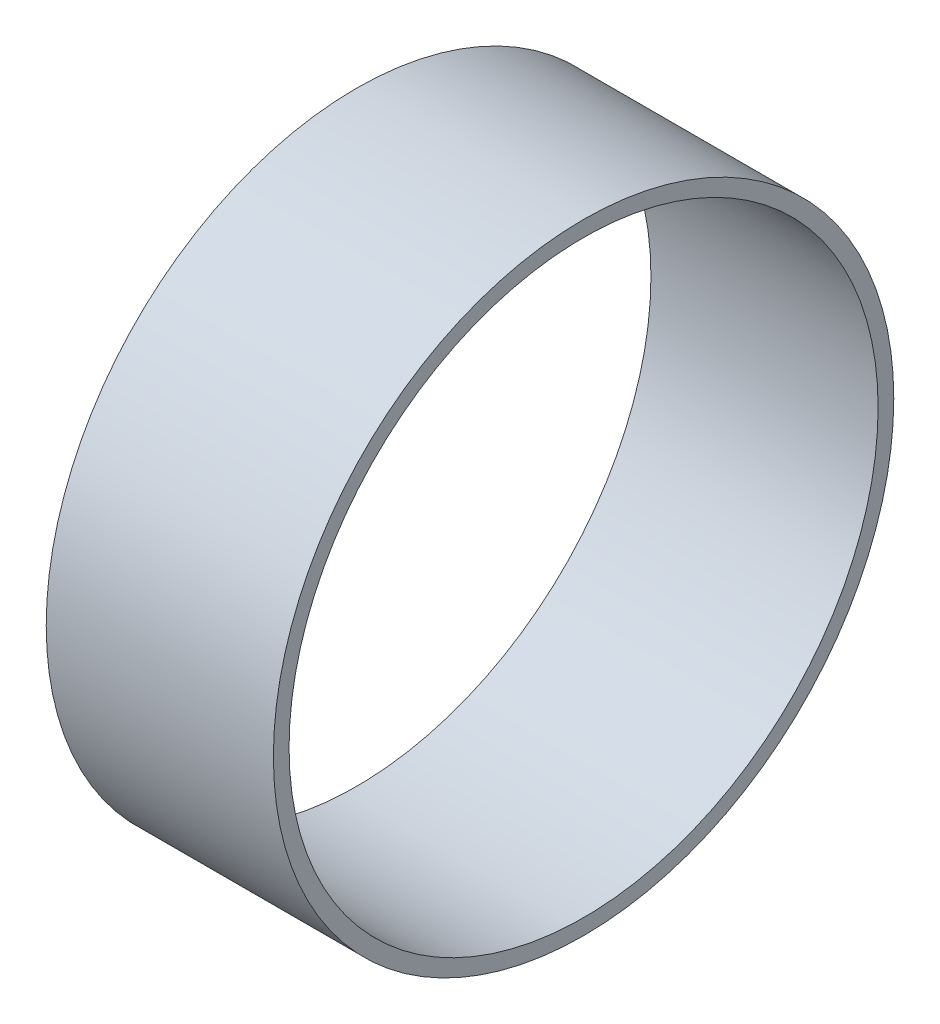
from build123d import *

# Parameters (mm, degrees)
ESQUISSE1_W = 14.5
ESQUISSE1_H = 1


with BuildPart() as part:
    # Esquisse1 → Base-Révol.-Mince (revolve)
    with BuildSketch(Plane.XY, mode=Mode.PRIVATE) as base_r_vol_mince_sk:
        with Locations((22.25, -19.3)):
            Rectangle(ESQUISSE1_W, ESQUISSE1_H)
    revolve(base_r_vol_mince_sk.sketch.rotate(Axis((0, 0, 0), (1, 0, 0)), 270), axis=Axis((0, 0, 0), (1, 0, 0)))


solid = part.part
